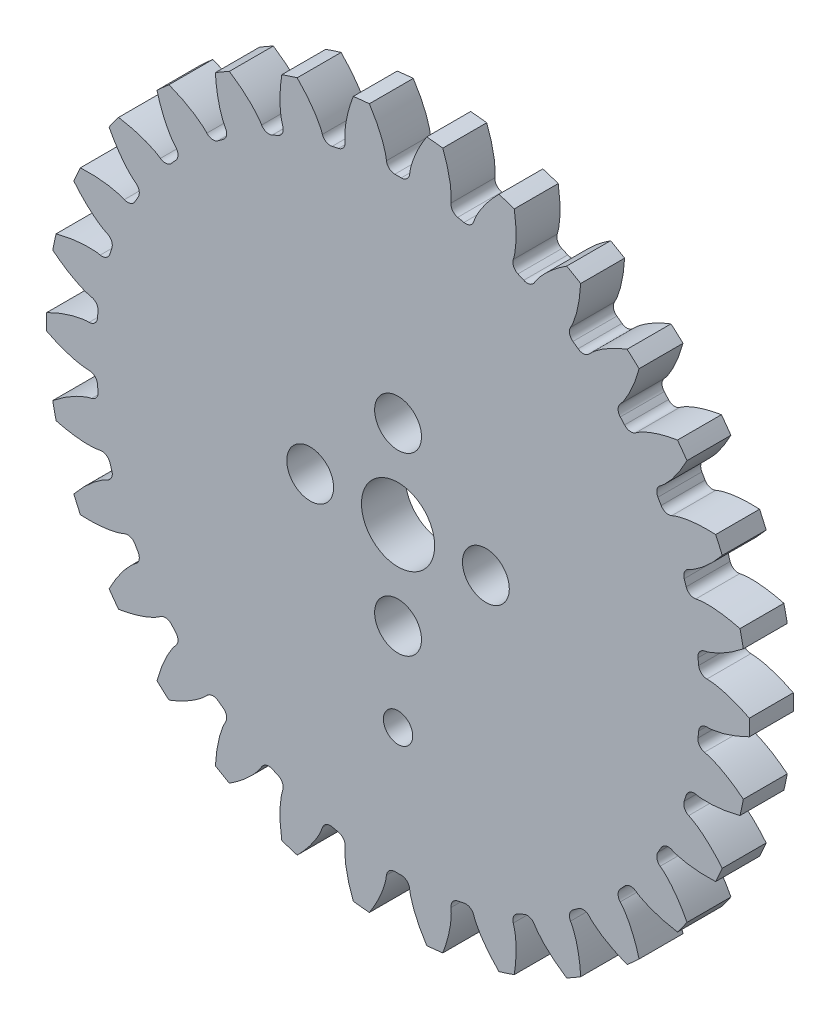
from build123d import *

# Parameters (mm, degrees)
SKETCH_1_R          = 24
LASHENA_DEPTH       = 3
CUT_EXTRUDEA_DEPTH  = 3
WWW_KYTOOL_CN_COUNT = 30
SKETCH_3_R          = 1.6
SKETCH_3_R_2        = 2.5
CUT_EXTRUDE_2_DEPTH = 35.0171108
SKETCH_4_R          = 1
CUT_EXTRUDE_3_DEPTH = 35.0171108


with BuildPart() as part:
    # 草图1 → LaShenA (new body)
    with BuildSketch(Plane.XY):
        Circle(SKETCH_1_R)
    extrude(amount=LASHENA_DEPTH)

    # SketchA → Cut-ExtrudeA (cut)
    with BuildSketch(Plane.XY.offset(3)):
        with BuildLine():
            ThreePointArc((0.21835648, 20.6238441), (0, 20.625), (-0.21835648, 20.6238441))
            ThreePointArc((-0.21835648, 20.6238441), (-0.602204976, 20.767014024), (-0.790881832, 21.130659923))
            add(Edge.make_bspline(
                [(-0.790881832, 21.130659923), (-0.792712726, 21.147083487), (-0.799807796, 21.208486598), (-0.811224099, 21.291013994), (-0.827882593, 21.380751008), (-0.842697648, 21.452838437), (-0.861156548, 21.533768203), (-0.883586313, 21.623426547), (-0.910378909, 21.721674061), (-0.94190051, 21.828363714), (-0.978519667, 21.943335309), (-1.02059813, 22.066417362), (-1.068493226, 22.197426692), (-1.122556711, 22.336168726), (-1.183134695, 22.482437593), (-1.250567248, 22.636016298), (-1.325188108, 22.796676879), (-1.407324362, 22.964180584), (-1.497296145, 23.138278048), (-1.595416337, 23.318709485), (-1.701990264, 23.505204882), (-1.817315406, 23.697484207), (-1.941681138, 23.895257616), (-2.075368325, 24.098225682), (-2.26997178, 24.380531299), (-2.425489689, 24.591274524), (-2.533891181, 24.732086381)],
                knots=[0.114616515, 0.114616515, 0.114616515, 0.114616515, 0.125462231, 0.155251243, 0.169304968, 0.185420009, 0.203596367, 0.223834041, 0.246133032, 0.270493339, 0.296914963, 0.325397903, 0.35594216, 0.388547734, 0.423214624, 0.459942831, 0.498732354, 0.539583194, 0.582495351, 0.627468824, 0.674503613, 0.72359972, 0.774757143, 0.827975882, 0.883255938, 1, 1, 1, 1], degree=3))
            ThreePointArc((-2.533891181, 24.732086381), (0, 24.861550661), (2.533891181, 24.732086381))
            add(Edge.make_bspline(
                [(0.790881832, 21.130659923), (0.792712726, 21.147083487), (0.799807796, 21.208486598), (0.811224099, 21.291013994), (0.827882593, 21.380751008), (0.842697648, 21.452838437), (0.861156548, 21.533768203), (0.883586313, 21.623426547), (0.910378909, 21.721674061), (0.94190051, 21.828363714), (0.978519667, 21.943335309), (1.02059813, 22.066417362), (1.068493226, 22.197426692), (1.122556711, 22.336168726), (1.183134695, 22.482437593), (1.250567248, 22.636016298), (1.325188108, 22.796676879), (1.407324362, 22.964180584), (1.497296145, 23.138278048), (1.595416337, 23.318709485), (1.701990264, 23.505204882), (1.817315406, 23.697484207), (1.941681138, 23.895257616), (2.075368325, 24.098225682), (2.26997178, 24.380531299), (2.425489689, 24.591274524), (2.533891181, 24.732086381)],
                knots=[0.114616515, 0.114616515, 0.114616515, 0.114616515, 0.125462231, 0.155251243, 0.169304968, 0.185420009, 0.203596367, 0.223834041, 0.246133032, 0.270493339, 0.296914963, 0.325397903, 0.35594216, 0.388547734, 0.423214624, 0.459942831, 0.498732354, 0.539583194, 0.582495351, 0.627468824, 0.674503613, 0.72359972, 0.774757143, 0.827975882, 0.883255938, 1, 1, 1, 1], degree=3))
            ThreePointArc((0.790881832, 21.130659923), (0.602204976, 20.767014024), (0.21835648, 20.6238441))
        make_face()
    cut_extrudea = extrude(amount=-CUT_EXTRUDEA_DEPTH, mode=Mode.SUBTRACT)

    # www.KYTool.cn: Cut-ExtrudeA ×30 about axis
    www_kytool_cn_axis = Axis((0, 0, -88.99), (0, 0, 1))
    for i in range(1, WWW_KYTOOL_CN_COUNT):
        add(cut_extrudea.rotate(www_kytool_cn_axis, i * 360 / WWW_KYTOOL_CN_COUNT), mode=Mode.SUBTRACT)

    # 草图3 → 切除-拉伸2 (cut, through all)
    with BuildSketch(Plane.XY.offset(3)):
        with Locations((6, 0)):
            Circle(SKETCH_3_R)
        with Locations((0, -6)):
            Circle(SKETCH_3_R)
        with Locations((-6, 0)):
            Circle(SKETCH_3_R)
        with Locations((0, 6)):
            Circle(SKETCH_3_R)
        Circle(SKETCH_3_R_2)
    extrude(amount=-CUT_EXTRUDE_2_DEPTH, mode=Mode.SUBTRACT)

    # 草图4 → 切除-拉伸3 (cut, through all)
    with BuildSketch(Plane.XY.offset(3)):
        with Locations((0, -12)):
            Circle(SKETCH_4_R)
    extrude(amount=-CUT_EXTRUDE_3_DEPTH, mode=Mode.SUBTRACT)


solid = part.part
